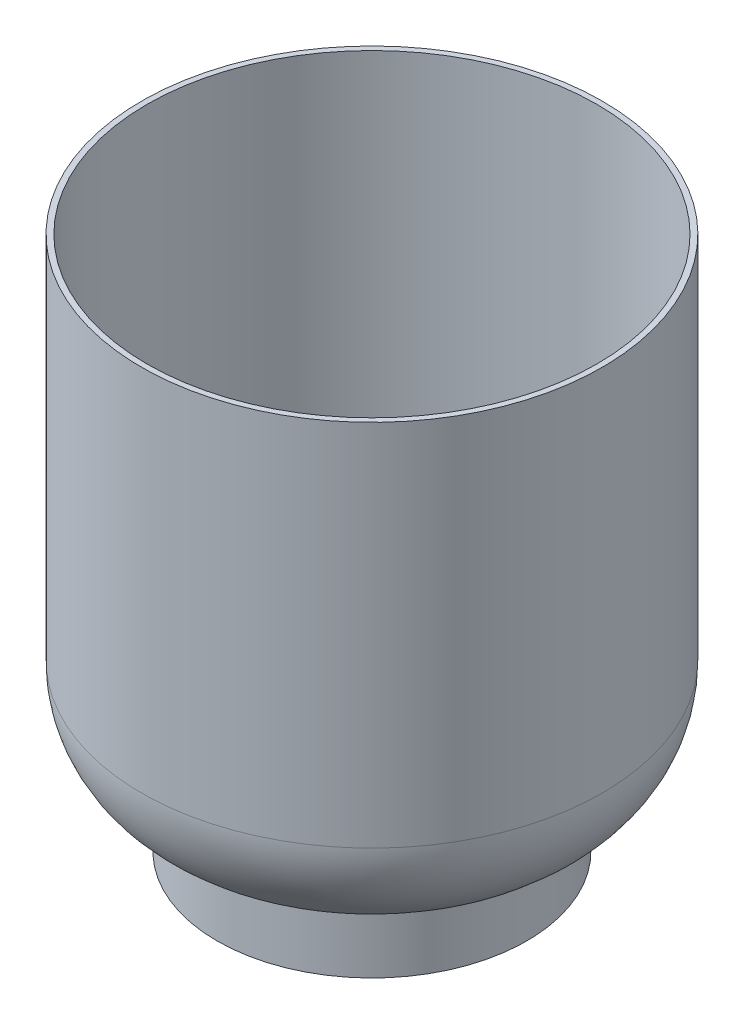
from build123d import *


with BuildPart() as part:
    # Çizim1 → Döndür5 (revolve)
    with BuildSketch(Plane.XY, mode=Mode.PRIVATE) as d_nd_r5_sk:
        with BuildLine():
            Line((-62.5, 80.513349387), (-62.5, -19.486650613))
            ThreePointArc((-62.5, -19.486650613), (-57.140269015, -36.599719971), (-42.976190476, -47.598026124))
            ThreePointArc((-42.976190476, -47.598026124), (-42.267986549, -48.147941431), (-42, -49.003594899))
            Line((-42, -49.003594899), (-42, -64.486650613))
            Line((-42, -64.486650613), (-40.5, -64.486650613))
            Line((-40.5, -64.486650613), (-40.5, -58.486650613))
            Line((-40.5, -58.486650613), (-34.5, -58.486650613))
            Line((-34.5, -58.486650613), (-34.5, -54.486650613))
            Line((-34.5, -54.486650613), (-40.5, -54.486650613))
            Line((-40.5, -54.486650613), (-40.5, -47.942757163))
            ThreePointArc((-40.5, -47.942757163), (-40.782933856, -47.065973267), (-41.525, -46.519951836))
            ThreePointArc((-41.525, -46.519951836), (-55.624256745, -36.145544634), (-61, -19.486650613))
            Line((-61, -19.486650613), (-61, 80.513349387))
            Line((-61, 80.513349387), (-62.5, 80.513349387))
        make_face()
    revolve(d_nd_r5_sk.sketch.rotate(Axis((0, 0, 0), (0, 1, 0)), 270), axis=Axis((0, 0, 0), (0, 1, 0)))


solid = part.part
